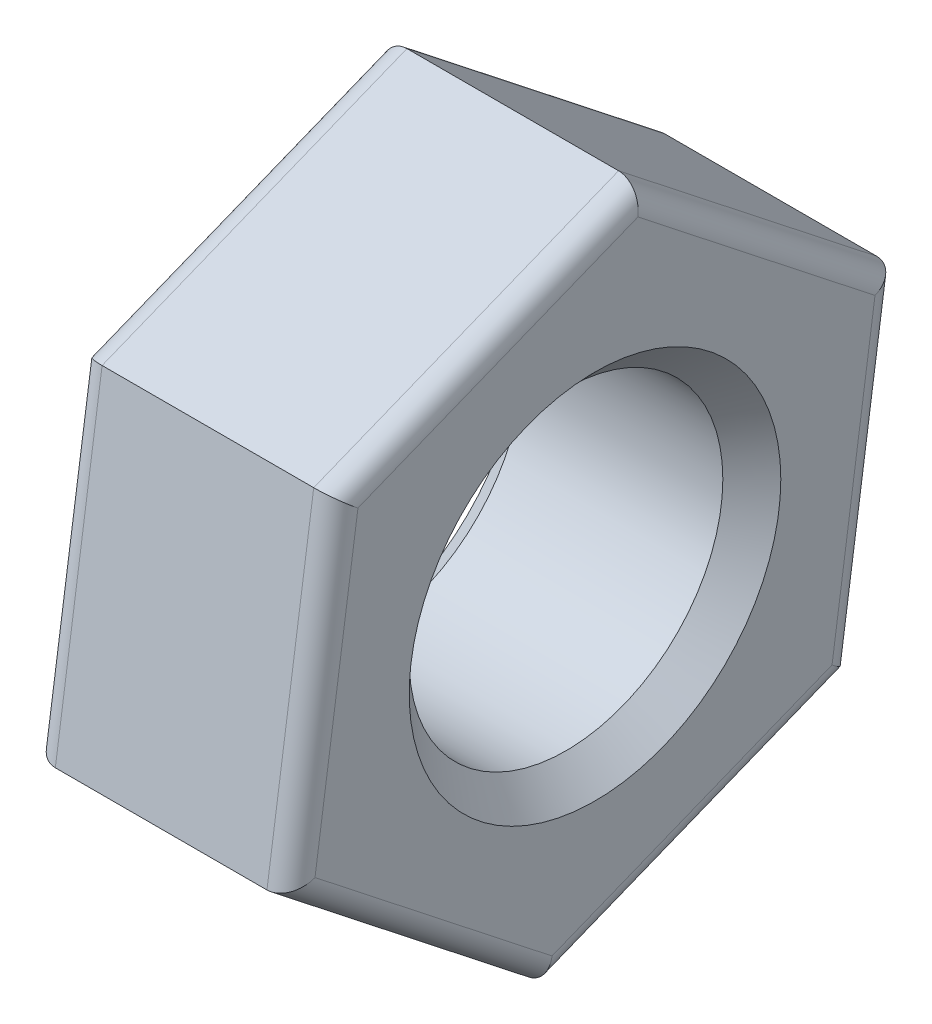
from build123d import *

# Parameters (mm, degrees)
SKETCH1_R           = 2.705
BOSS_EXTRUDE1_DEPTH = 4.45
CHAMFER1_SIZE       = 0.5
FILLET1_R           = 0.4


with BuildPart() as part:
    # Sketch1 → Boss-Extrude1 (new body)
    with BuildSketch(Plane(origin=(0, 0, 0), x_dir=(0, 0, -1), z_dir=(1, 0, 0))):
        Polygon((0.806629144, 5.606072549), (-4.451686671, 3.501597604), (-5.258315815, -2.104474945), (-0.806629144, -5.606072549), (4.451686671, -3.501597604), (5.258315815, 2.104474945), align=None)
        Circle(SKETCH1_R, mode=Mode.SUBTRACT)
    extrude(amount=BOSS_EXTRUDE1_DEPTH)

    # Chamfer1
    chamfer1_edges = [part.edges().sort_by_distance(p)[0] for p in [
        (0, 0, 2.705),
        (4.45, 0, 2.705),
    ]]
    chamfer(chamfer1_edges, length=CHAMFER1_SIZE)

    # Fillet1
    fillet1_edges = [part.edges().sort_by_distance(p)[0] for p in [
        (4.45, 0.69856133, 4.855001243),
        (4.45, -3.855273747, 3.032472479),
        (4.45, -4.553835077, -1.822528764),
        (4.45, -0.69856133, -4.855001243),
        (4.45, 3.855273747, -3.032472479),
        (0, -0.69856133, -4.855001243),
        (0, -4.553835077, -1.822528764),
        (0, -3.855273747, 3.032472479),
        (0, 0.69856133, 4.855001243),
        (0, 4.553835077, 1.822528764),
        (0, 3.855273747, -3.032472479),
        (4.45, 4.553835077, 1.822528764),
    ]]
    fillet(fillet1_edges, radius=FILLET1_R)


solid = part.part
